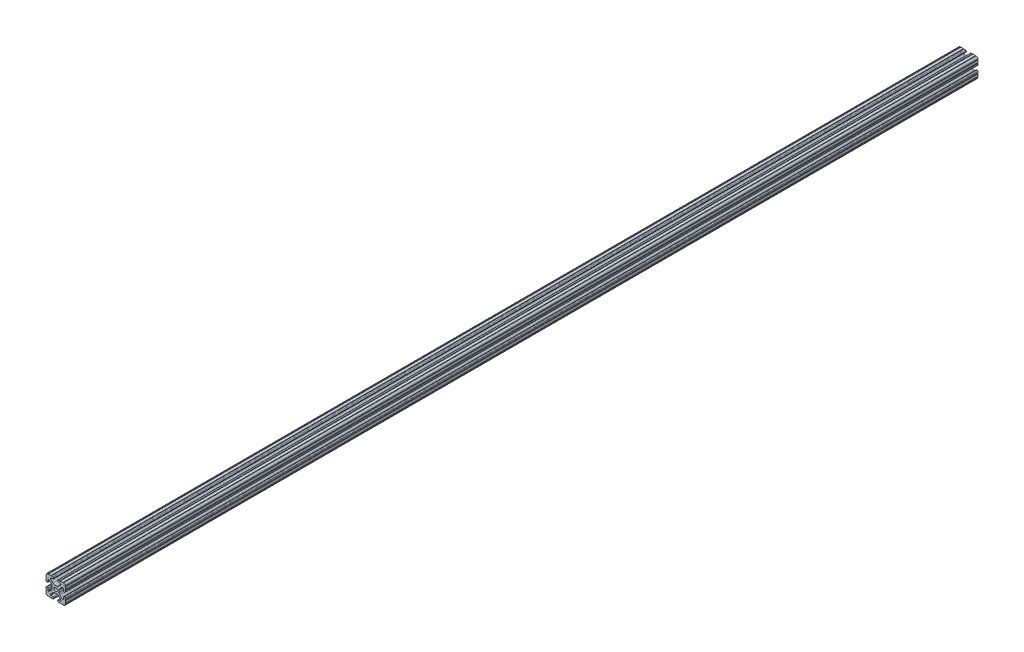
from build123d import *

# Parameters (mm, degrees)
SKETCH1_R      = 3.3274
EXTRUDE1_DEPTH = 1800


with BuildPart() as part:
    # Sketch1 → Extrude1 (new body)
    with BuildSketch(Plane.XY):
        with BuildLine():
            Line((-10.022898969, 12.91475973), (-5.252158105, 8.144007132))
            ThreePointArc((-5.252158105, 8.144007132), (-3.715177372, 7.117027388), (-1.902183975, 6.7564))
            Line((-1.902183975, 6.7564), (1.902183975, 6.7564))
            ThreePointArc((1.902183975, 6.7564), (3.715177372, 7.117027388), (5.252158105, 8.144007132))
            Line((5.252158105, 8.144007132), (10.022898969, 12.91475973))
            ThreePointArc((10.022898969, 12.91475973), (10.218362387, 13.207291992), (10.287, 13.552357131))
            Line((10.287, 13.552357131), (10.287, 14.0843))
            ThreePointArc((10.287, 14.0843), (10.022898185, 14.721898185), (9.3853, 14.986))
            Line((9.3853, 14.986), (5.617617549, 14.986))
            ThreePointArc((5.617617549, 14.986), (4.519044045, 15.441044045), (4.064, 16.539617549))
            Line((4.064, 16.539617549), (4.064, 17.496382451))
            ThreePointArc((4.064, 17.496382451), (4.519044045, 18.594955955), (5.617617549, 19.05))
            Line((5.617617549, 19.05), (7.974178704, 19.05))
            ThreePointArc((7.974178704, 19.05), (8.736178704, 18.288), (9.498178704, 19.05))
            Line((9.498178704, 19.05), (14.327719207, 19.05))
            ThreePointArc((14.327719207, 19.05), (15.087603123, 18.231251131), (15.847487039, 19.05))
            ThreePointArc((15.847487039, 19.05), (18.120176289, 18.120192083), (19.05, 15.847509295))
            ThreePointArc((19.05, 15.847509295), (18.231250992, 15.08762539), (19.05, 14.327741484))
            Line((19.05, 14.327741484), (19.05, 9.496091471))
            ThreePointArc((19.05, 9.496091471), (18.231250992, 8.736207565), (19.05, 7.97632366))
            Line((19.05, 7.97632366), (19.05, 5.617617549))
            ThreePointArc((19.05, 5.617617549), (18.594955955, 4.519044045), (17.496382451, 4.064))
            Line((17.496382451, 4.064), (16.539617549, 4.064))
            ThreePointArc((16.539617549, 4.064), (15.441044045, 4.519044045), (14.986, 5.617617549))
            Line((14.986, 5.617617549), (14.986, 9.385342516))
            ThreePointArc((14.986, 9.385342516), (14.721898185, 10.022940701), (14.0843, 10.287042516))
            Line((14.0843, 10.287042516), (13.516042086, 10.287042516))
            ThreePointArc((13.516042086, 10.287042516), (13.170975923, 10.218404478), (12.878443117, 10.022939917))
            Line((12.878443117, 10.022939917), (8.14758008, 5.292065243))
            ThreePointArc((8.14758008, 5.292065243), (7.117955879, 3.751120653), (6.7564, 1.933453584))
            Line((6.7564, 1.933453584), (6.7564, -1.933453584))
            ThreePointArc((6.7564, -1.933453584), (7.117955879, -3.751120653), (8.14758008, -5.292065243))
            Line((8.14758008, -5.292065243), (12.878443117, -10.022939917))
            ThreePointArc((12.878443117, -10.022939917), (13.170975923, -10.218404478), (13.516042086, -10.287042516))
            Line((13.516042086, -10.287042516), (14.0843, -10.287042516))
            ThreePointArc((14.0843, -10.287042516), (14.721898185, -10.022940701), (14.986, -9.385342516))
            Line((14.986, -9.385342516), (14.986, -5.617617549))
            ThreePointArc((14.986, -5.617617549), (15.441044045, -4.519044045), (16.539617549, -4.064))
            Line((16.539617549, -4.064), (17.496382451, -4.064))
            ThreePointArc((17.496382451, -4.064), (18.594955955, -4.519044045), (19.05, -5.617617549))
            Line((19.05, -5.617617549), (19.05, -7.976318491))
            ThreePointArc((19.05, -7.976318491), (18.231250992, -8.736202396), (19.05, -9.496086302))
            Line((19.05, -9.496086302), (19.05, -14.32774291))
            ThreePointArc((19.05, -14.32774291), (18.231250992, -15.087626816), (19.05, -15.847510721))
            ThreePointArc((19.05, -15.847510721), (18.120175716, -18.120192644), (15.847486868, -19.05))
            ThreePointArc((15.847486868, -19.05), (15.087602952, -18.231251131), (14.327719036, -19.05))
            Line((14.327719036, -19.05), (9.496062448, -19.05))
            ThreePointArc((9.496062448, -19.05), (8.736178532, -18.231251131), (7.976294616, -19.05))
            Line((7.976294616, -19.05), (5.617617549, -19.05))
            ThreePointArc((5.617617549, -19.05), (4.519044045, -18.594955955), (4.064, -17.496382451))
            Line((4.064, -17.496382451), (4.064, -16.539617549))
            ThreePointArc((4.064, -16.539617549), (4.519044045, -15.441044045), (5.617617549, -14.986))
            Line((5.617617549, -14.986), (9.3853, -14.986))
            ThreePointArc((9.3853, -14.986), (10.022898185, -14.721898185), (10.287, -14.0843))
            Line((10.287, -14.0843), (10.287, -13.552357131))
            ThreePointArc((10.287, -13.552357131), (10.218362387, -13.207291992), (10.022898969, -12.91475973))
            Line((10.022898969, -12.91475973), (5.252158105, -8.144007132))
            ThreePointArc((5.252158105, -8.144007132), (3.715177372, -7.117027388), (1.902183975, -6.7564))
            Line((1.902183975, -6.7564), (-1.902183975, -6.7564))
            ThreePointArc((-1.902183975, -6.7564), (-3.715177372, -7.117027388), (-5.252158105, -8.144007132))
            Line((-5.252158105, -8.144007132), (-10.022898969, -12.91475973))
            ThreePointArc((-10.022898969, -12.91475973), (-10.218362387, -13.207291992), (-10.287, -13.552357131))
            Line((-10.287, -13.552357131), (-10.287, -14.0843))
            ThreePointArc((-10.287, -14.0843), (-10.022898185, -14.721898185), (-9.3853, -14.986))
            Line((-9.3853, -14.986), (-5.617617549, -14.986))
            ThreePointArc((-5.617617549, -14.986), (-4.519044045, -15.441044045), (-4.064, -16.539617549))
            Line((-4.064, -16.539617549), (-4.064, -17.496382451))
            ThreePointArc((-4.064, -17.496382451), (-4.519044045, -18.594955955), (-5.617617549, -19.05))
            Line((-5.617617549, -19.05), (-7.976294616, -19.05))
            ThreePointArc((-7.976294616, -19.05), (-8.736178532, -18.231251131), (-9.496062448, -19.05))
            Line((-9.496062448, -19.05), (-14.327719036, -19.05))
            ThreePointArc((-14.327719036, -19.05), (-15.087602952, -18.231251131), (-15.847486868, -19.05))
            ThreePointArc((-15.847486868, -19.05), (-18.120175716, -18.120192644), (-19.05, -15.847510721))
            ThreePointArc((-19.05, -15.847510721), (-18.231250992, -15.087626816), (-19.05, -14.32774291))
            Line((-19.05, -14.32774291), (-19.05, -9.496086302))
            ThreePointArc((-19.05, -9.496086302), (-18.231250992, -8.736202396), (-19.05, -7.976318491))
            Line((-19.05, -7.976318491), (-19.05, -5.617617549))
            ThreePointArc((-19.05, -5.617617549), (-18.594955955, -4.519044045), (-17.496382451, -4.064))
            Line((-17.496382451, -4.064), (-16.539617549, -4.064))
            ThreePointArc((-16.539617549, -4.064), (-15.441044045, -4.519044045), (-14.986, -5.617617549))
            Line((-14.986, -5.617617549), (-14.986, -9.385342516))
            ThreePointArc((-14.986, -9.385342516), (-14.721898185, -10.022940701), (-14.0843, -10.287042516))
            Line((-14.0843, -10.287042516), (-13.516042086, -10.287042516))
            ThreePointArc((-13.516042086, -10.287042516), (-13.170975923, -10.218404478), (-12.878443117, -10.022939917))
            Line((-12.878443117, -10.022939917), (-8.14758008, -5.292065243))
            ThreePointArc((-8.14758008, -5.292065243), (-7.117955879, -3.751120653), (-6.7564, -1.933453584))
            Line((-6.7564, -1.933453584), (-6.7564, 1.933453584))
            ThreePointArc((-6.7564, 1.933453584), (-7.117955879, 3.751120653), (-8.14758008, 5.292065243))
            Line((-8.14758008, 5.292065243), (-12.878443117, 10.022939917))
            ThreePointArc((-12.878443117, 10.022939917), (-13.170975923, 10.218404478), (-13.516042086, 10.287042516))
            Line((-13.516042086, 10.287042516), (-14.0843, 10.287042516))
            ThreePointArc((-14.0843, 10.287042516), (-14.721898185, 10.022940701), (-14.986, 9.385342516))
            Line((-14.986, 9.385342516), (-14.986, 5.617617549))
            ThreePointArc((-14.986, 5.617617549), (-15.441044045, 4.519044045), (-16.539617549, 4.064))
            Line((-16.539617549, 4.064), (-17.496382451, 4.064))
            ThreePointArc((-17.496382451, 4.064), (-18.594955955, 4.519044045), (-19.05, 5.617617549))
            Line((-19.05, 5.617617549), (-19.05, 7.97632366))
            ThreePointArc((-19.05, 7.97632366), (-18.231250992, 8.736207565), (-19.05, 9.496091471))
            Line((-19.05, 9.496091471), (-19.05, 14.327741484))
            ThreePointArc((-19.05, 14.327741484), (-18.231250992, 15.08762539), (-19.05, 15.847509295))
            ThreePointArc((-19.05, 15.847509295), (-18.120176289, 18.120192083), (-15.847487039, 19.05))
            ThreePointArc((-15.847487039, 19.05), (-15.087603123, 18.231251131), (-14.327719207, 19.05))
            Line((-14.327719207, 19.05), (-9.498178704, 19.05))
            ThreePointArc((-9.498178704, 19.05), (-8.736178704, 18.288), (-7.974178704, 19.05))
            Line((-7.974178704, 19.05), (-5.617617549, 19.05))
            ThreePointArc((-5.617617549, 19.05), (-4.519044045, 18.594955955), (-4.064, 17.496382451))
            Line((-4.064, 17.496382451), (-4.064, 16.539617549))
            ThreePointArc((-4.064, 16.539617549), (-4.519044045, 15.441044045), (-5.617617549, 14.986))
            Line((-5.617617549, 14.986), (-9.3853, 14.986))
            ThreePointArc((-9.3853, 14.986), (-10.022898185, 14.721898185), (-10.287, 14.0843))
            Line((-10.287, 14.0843), (-10.287, 13.552357131))
            ThreePointArc((-10.287, 13.552357131), (-10.218362387, 13.207291992), (-10.022898969, 12.91475973))
        make_face()
        Circle(SKETCH1_R, mode=Mode.SUBTRACT)
    extrude(amount=-EXTRUDE1_DEPTH)


solid = part.part
